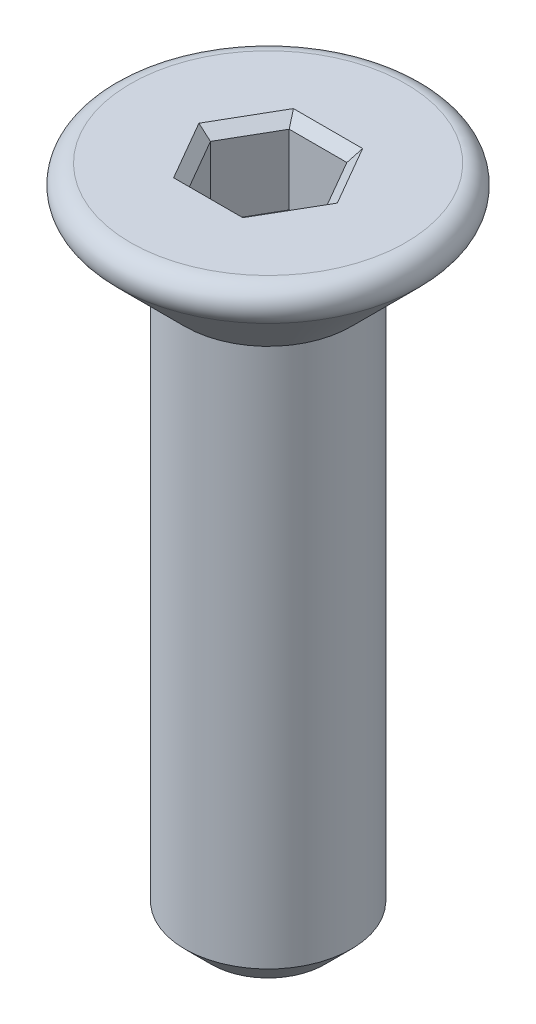
from build123d import *

# Parameters (mm, degrees)
ENL_V_MAT_EXTRU_1_DEPTH = 1.2
CHANFREIN1_SIZE         = 0.15


with BuildPart() as part:
    # Esquisse1 → Révolution1 (revolve)
    with BuildSketch(Plane.XY, mode=Mode.PRIVATE) as r_volution1_sk:
        with BuildLine():
            Line((1.25, -9.6), (0.85, -10))
            Line((0.85, -10), (0, -10))
            Line((0, -10), (0, 0))
            Line((0, 0), (2.067157288, 0))
            ThreePointArc((2.067157288, 0), (2.328469881, -0.174603492), (2.267157288, -0.482842712))
            Line((2.267157288, -0.482842712), (1.25, -1.5))
            Line((1.25, -1.5), (1.25, -9.6))
        make_face()
    revolve(r_volution1_sk.sketch.rotate(Axis((0, 6.972972973, 0), (0, -1, 0)), 90), axis=Axis((0, 6.972972973, 0), (0, -1, 0)))

    # Esquisse2 → Enlèv. mat.-Extru.1 (cut)
    with BuildSketch(Plane(origin=(0, 0, 0), x_dir=(1, 0, 0), z_dir=(0, 1, 0))):
        Polygon((-0.866025404, 0), (-0.433012702, -0.75), (0.433012702, -0.75), (0.866025404, 0), (0.433012702, 0.75), (-0.433012702, 0.75), align=None)
    extrude(amount=-ENL_V_MAT_EXTRU_1_DEPTH, mode=Mode.SUBTRACT)

    # Chanfrein1
    chanfrein1_edges = [part.edges().sort_by_distance(p)[0] for p in [
        (-0.649519053, 0, -0.375),
        (-0.649519053, 0, 0.375),
        (0, 0, 0.75),
        (0.649519053, 0, 0.375),
        (0.649519053, 0, -0.375),
        (0, 0, -0.75),
    ]]
    chamfer(chanfrein1_edges, length=CHANFREIN1_SIZE)


solid = part.part
